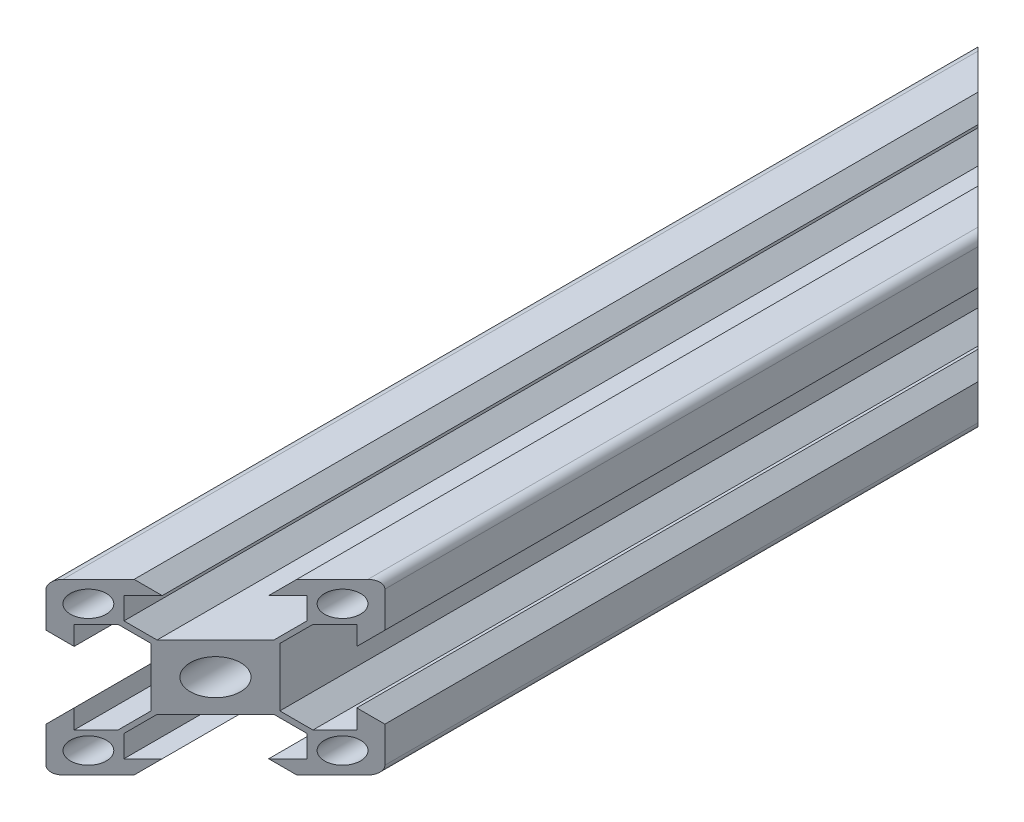
from build123d import *

# Parameters (mm, degrees)
SKETCH_1_R          = 1.5
SKETCH_1_R_2        = 2.1
EXTRUDE_1_DEPTH     = 55
FILLET_1_R          = 1
CUT_EXTRUDE_1_REACH = 99.788
SKETCH_2_W          = 29.048666984
SKETCH_2_H          = 34.015307271


with BuildPart() as part:
    # 草图1 → 凸台-拉伸1 (new, symmetric)
    with BuildSketch(Plane.XY):
        Polygon((-10, 10), (-10, 4.8), (-8.34, 3.14), (-8.34, 5.4), (-5.753553391, 5.4), (-3.8, 3.446446609), (-3.8, -3.446446609), (-5.753553391, -5.4), (-8.34, -5.4), (-8.34, -3.14), (-10, -4.8), (-10, -10), (-4.8, -10), (-3.14, -8.34), (-5.4, -8.34), (-5.4, -5.753553391), (-3.446446609, -3.8), (3.446446609, -3.8), (5.4, -5.753553391), (5.4, -8.34), (3.14, -8.34), (4.8, -10), (10, -10), (10, -4.8), (8.34, -3.14), (8.34, -5.4), (5.753553391, -5.4), (3.8, -3.446446609), (3.8, 3.446446609), (5.753553391, 5.4), (8.34, 5.4), (8.34, 3.14), (10, 4.8), (10, 10), (4.8, 10), (3.14, 8.34), (5.4, 8.34), (5.4, 5.753553391), (3.446446609, 3.8), (-3.446446609, 3.8), (-5.4, 5.753553391), (-5.4, 8.34), (-3.14, 8.34), (-4.8, 10), align=None)
        with Locations((-7.5, 7.5)):
            Circle(SKETCH_1_R, mode=Mode.SUBTRACT)
        Circle(SKETCH_1_R_2, mode=Mode.SUBTRACT)
        with Locations(Location((-7.5, -7.5, 0), (0, 0, 180))):
            Circle(SKETCH_1_R, mode=Mode.SUBTRACT)
        with Locations((7.5, -7.5)):
            Circle(SKETCH_1_R, mode=Mode.SUBTRACT)
        with Locations(Location((7.5, 7.5, 0), (0, 0, 180))):
            Circle(SKETCH_1_R, mode=Mode.SUBTRACT)
    extrude(amount=EXTRUDE_1_DEPTH, both=True)

    # 圆角1
    fillet_1_edges = [part.edges().sort_by_distance(p)[0] for p in [
        (10, 10, 0),
        (10, -10, 0),
        (-10, -10, 0),
        (-10, 10, 0),
    ]]
    fillet(fillet_1_edges, radius=FILLET_1_R)

    # 草图2 → 切除-拉伸1 (cut, up to next)
    with BuildSketch(Plane(origin=(-32.5, 0, -32.5), x_dir=(0, -1, 0), z_dir=(0.7071067811865464, 0, 0.7071067811865488)), mode=Mode.PRIVATE) as cut_extrude_1_sk1:
        with Locations((-4.05016126, 48.827458789)):
            Rectangle(SKETCH_2_W, SKETCH_2_H)
    cut_extrude_1_tool1 = extrude(cut_extrude_1_sk1.sketch, amount=CUT_EXTRUDE_1_REACH, mode=Mode.PRIVATE) & part.part
    cut_extrude_1 = cut_extrude_1_tool1.solids().sort_by_distance((2.026227, 4.050161, -67.026227))[0]
    add(cut_extrude_1, mode=Mode.SUBTRACT)

    # 镜向1: 切除-拉伸1 across plane
    add(cut_extrude_1.mirror(Plane(origin=(0, 0, 0), x_dir=(1, 0, 0), z_dir=(0, 0, -1))), mode=Mode.SUBTRACT)


solid = part.part
